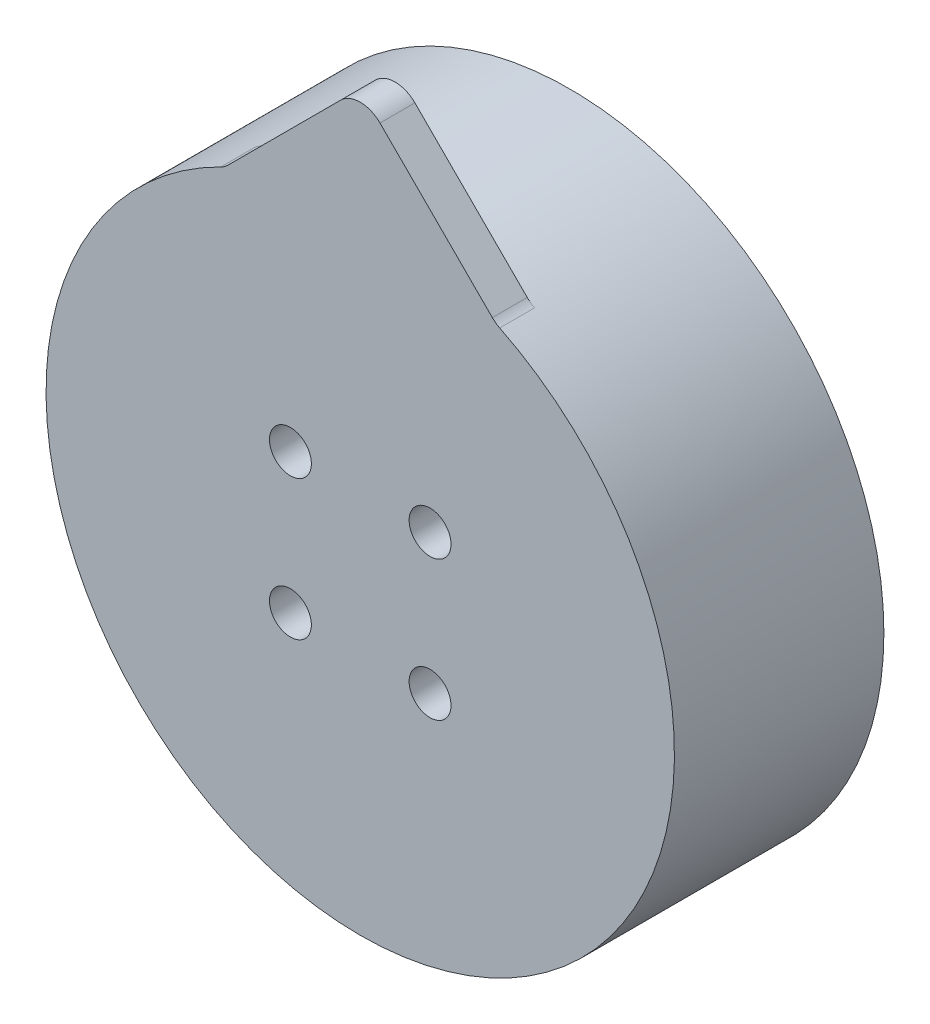
from build123d import *

# Parameters (mm, degrees)
SKETCH1_R           = 28.575
SKETCH1_R_2         = 21.844
BOSS_EXTRUDE1_DEPTH = 12.7
SKETCH2_R           = 28.575
BOSS_EXTRUDE2_DEPTH = 6.35
BOSS_EXTRUDE3_START = -3.175
BOSS_EXTRUDE3_DEPTH = 3.175
FILLET1_R           = 2.54
SKETCH4_R           = 1.5875
CUT_EXTRUDE1_DEPTH  = 12.7
SKETCH5_R           = 3.175
CUT_EXTRUDE2_DEPTH  = 3.175
SKETCH6_R           = 1.905
CUT_EXTRUDE3_DEPTH  = 50.407418097


with BuildPart() as part:
    # Sketch1 → Boss-Extrude1 (new body)
    with BuildSketch(Plane.XY):
        Circle(SKETCH1_R)
        Circle(SKETCH1_R_2, mode=Mode.SUBTRACT)
    extrude(amount=BOSS_EXTRUDE1_DEPTH)

    # Sketch2 → Boss-Extrude2 (add)
    with BuildSketch(Plane.XY.offset(12.7)):
        Circle(SKETCH2_R)
    extrude(amount=BOSS_EXTRUDE2_DEPTH)

    # Sketch3 → Boss-Extrude3 (add)
    with BuildSketch(Plane.XY.offset(19.05).offset(BOSS_EXTRUDE3_START)):
        with BuildLine():
            Line((-12.314807909, 25.785192091), (0, 38.1))
            Line((0, 38.1), (12.314807909, 25.785192091))
            ThreePointArc((12.314807909, 25.785192091), (0, 28.575), (-12.314807909, 25.785192091))
        make_face()
    extrude(amount=BOSS_EXTRUDE3_DEPTH)

    # Fillet1
    fillet1_edges = [part.edges().sort_by_distance(p)[0] for p in [
        (12.314807909, 25.785192091, 17.4625),
        (-12.314807909, 25.785192091, 17.4625),
        (0, 38.1, 17.4625),
    ]]
    fillet(fillet1_edges, radius=FILLET1_R)

    # Sketch4 → Cut-Extrude1 (cut)
    with BuildSketch(Plane(origin=(0, 0, 0), x_dir=(-1, 0, 0), z_dir=(0, 0, -1))):
        with Locations((0, 21.844)):
            Circle(SKETCH4_R)
        with Locations((15.446040528, 15.446040528)):
            Circle(SKETCH4_R)
        with Locations((21.844, 0)):
            Circle(SKETCH4_R)
        with Locations((15.446040528, -15.446040528)):
            Circle(SKETCH4_R)
        with Locations((0, -21.844)):
            Circle(SKETCH4_R)
        with Locations((-15.446040528, -15.446040528)):
            Circle(SKETCH4_R)
        with Locations((-21.844, 0)):
            Circle(SKETCH4_R)
        with Locations((-15.446040528, 15.446040528)):
            Circle(SKETCH4_R)
    extrude(amount=-CUT_EXTRUDE1_DEPTH, mode=Mode.SUBTRACT)

    # Sketch5 → Cut-Extrude2 (cut)
    with BuildSketch(Plane(origin=(0, 0, 12.7), x_dir=(-1, 0, 0), z_dir=(0, 0, -1))):
        with Locations((-6.35, 6.35)):
            Circle(SKETCH5_R)
        with Locations((6.35, 6.35)):
            Circle(SKETCH5_R)
        with Locations((6.35, -6.35)):
            Circle(SKETCH5_R)
        with Locations((-6.35, -6.35)):
            Circle(SKETCH5_R)
    extrude(amount=-CUT_EXTRUDE2_DEPTH, mode=Mode.SUBTRACT)

    # Sketch6 → Cut-Extrude3 (cut, through all)
    with BuildSketch(Plane(origin=(0, 0, 15.875), x_dir=(-1, 0, 0), z_dir=(0, 0, -1))):
        with Locations((-6.35, 6.35)):
            Circle(SKETCH6_R)
        with Locations((6.35, 6.35)):
            Circle(SKETCH6_R)
        with Locations((6.35, -6.35)):
            Circle(SKETCH6_R)
        with Locations((-6.35, -6.35)):
            Circle(SKETCH6_R)
    extrude(amount=-CUT_EXTRUDE3_DEPTH, mode=Mode.SUBTRACT)


solid = part.part
